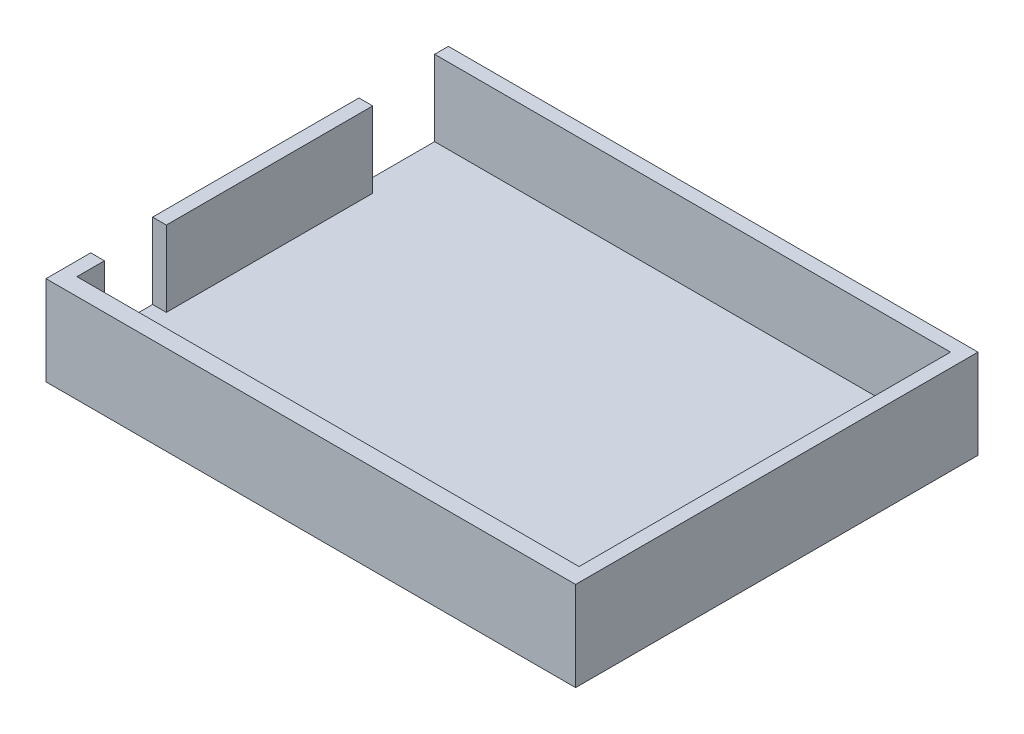
from build123d import *

# Parameters (mm, degrees)
SKETCH_1_W          = 77
SKETCH_1_H          = 58.5
EXTRUDE_1_DEPTH     = 2
SKETCH_2_W          = 77
SKETCH_2_H          = 58.5
SKETCH_2_W_2        = 73
SKETCH_2_H_2        = 54
EXTRUDE_2_DEPTH     = 11
CUT_EXTRUDE_1_REACH = 85.388
SKETCH_3_W          = 9
SKETCH_3_H          = 11
SKETCH_3_W_2        = 11


with BuildPart() as part:
    # 草图1 → 凸台-拉伸1 (new body)
    with BuildSketch(Plane(origin=(0, 0, 0), x_dir=(1, 0, 0), z_dir=(0, 1, 0))):
        Rectangle(SKETCH_1_W, SKETCH_1_H)
    extrude(amount=EXTRUDE_1_DEPTH)

    # 草图2 → 凸台-拉伸2 (add)
    with BuildSketch(Plane(origin=(0, 2, 0), x_dir=(1, 0, 0), z_dir=(0, 1, 0))):
        Rectangle(SKETCH_2_W, SKETCH_2_H)
        with Locations((0, 0.25)):
            Rectangle(SKETCH_2_W_2, SKETCH_2_H_2, mode=Mode.SUBTRACT)
    extrude(amount=EXTRUDE_2_DEPTH)

    # 草图3 → 切除-拉伸1 (cut, up to next)
    with BuildSketch(Plane.ZY.offset(38.5), mode=Mode.PRIVATE) as cut_extrude_1_sk1:
        with Locations((18.25, 7.5)):
            Rectangle(SKETCH_3_W, SKETCH_3_H)
    cut_extrude_1_tool1 = extrude(cut_extrude_1_sk1.sketch, amount=-CUT_EXTRUDE_1_REACH, mode=Mode.PRIVATE) & part.part
    # 草图3 → 切除-拉伸1 (cut, up to next)
    with BuildSketch(Plane.ZY.offset(38.5), mode=Mode.PRIVATE) as cut_extrude_1_sk2:
        with Locations((-21.75, 7.5)):
            Rectangle(SKETCH_3_W_2, SKETCH_3_H)
    cut_extrude_1_tool2 = extrude(cut_extrude_1_sk2.sketch, amount=-CUT_EXTRUDE_1_REACH, mode=Mode.PRIVATE) & part.part
    add(cut_extrude_1_tool1.solids().sort_by_distance((-38.5, 7.5, 18.25))[0], mode=Mode.SUBTRACT)
    add(cut_extrude_1_tool2.solids().sort_by_distance((-38.5, 7.5, -21.75))[0], mode=Mode.SUBTRACT)


solid = part.part
